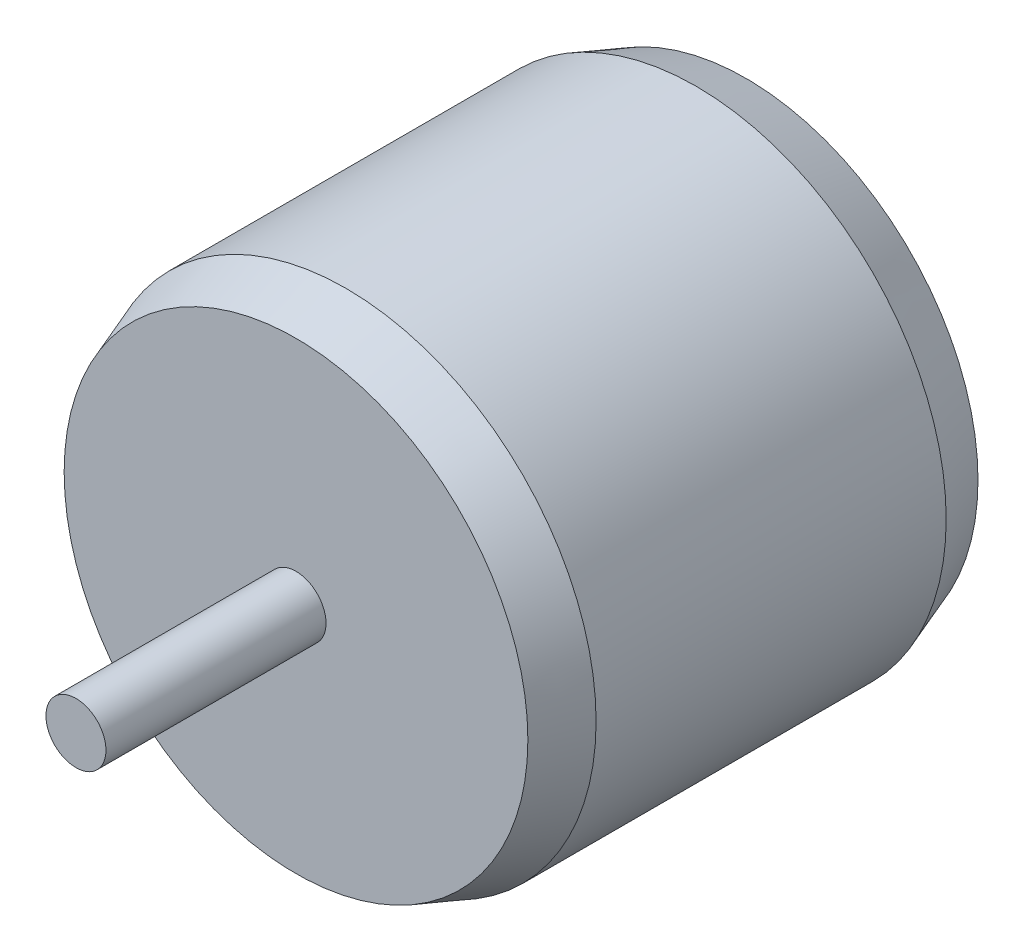
from build123d import *

# Parameters (mm, degrees)
SKETCH1_R           = 25
BOSS_EXTRUDE1_DEPTH = 45
CHAMFER1_SIZE       = 5
CHAMFER1_SIZE2      = 1.819851171
SKETCH2_R           = 3
BOSS_EXTRUDE2_DEPTH = 22
BOSS_EXTRUDE3_START = 2
SKETCH3_R           = 3
BOSS_EXTRUDE3_DEPTH = 2
CIRPATTERN1_COUNT   = 4


with BuildPart() as part:
    # Sketch1 → Boss-Extrude1 (new body)
    with BuildSketch(Plane.XY):
        with Locations(Location((0, 0, 0), (0, 0, 180))):
            Circle(SKETCH1_R)
    extrude(amount=BOSS_EXTRUDE1_DEPTH)

    # Chamfer1
    chamfer1_edges = [part.edges().sort_by_distance(p)[0] for p in [
        (25, 0, 0),
        (25, 0, 45),
    ]]
    chamfer1_side = [part.faces().sort_by_distance(p)[0] for p in [
        (25, 0, 22.5),
    ]]
    chamfer(chamfer1_edges, length=CHAMFER1_SIZE, length2=CHAMFER1_SIZE2, reference=chamfer1_side[0])

    # Sketch2 → Boss-Extrude2 (add)
    with BuildSketch(Plane.XY.offset(45)):
        Circle(SKETCH2_R)
    extrude(amount=BOSS_EXTRUDE2_DEPTH)

    # Sketch3 → Boss-Extrude3 (add)
    with BuildSketch(Plane(origin=(0, 0, 0), x_dir=(-1, 0, 0), z_dir=(0, 0, -1)).offset(BOSS_EXTRUDE3_START)):
        with Locations(Location((0, 0, 0), (0, 0, 180))):
            Circle(SKETCH3_R)
    extrude(amount=-BOSS_EXTRUDE3_DEPTH)

    # Sketch5 → Tap Drill for M3x0.5 Tap1 (revolve, cut)
    with BuildSketch(Plane(origin=(0, 10, 0), x_dir=(0, 1, 0), z_dir=(1, 0, 0))):
        Polygon((0, 0), (0, 10.751075774), (1.25, 10), (1.25, 0), align=None)
    tap_drill_for_m3x0_5_tap1 = revolve(axis=Axis((0, 10, -6.35), (0, 0, 1)), mode=Mode.SUBTRACT)

    # CirPattern1: Tap Drill for M3x0.5 Tap1 ×4 about axis
    cirpattern1_axis = Axis((0, 0, 0), (0, 0, 1))
    for i in range(1, CIRPATTERN1_COUNT):
        add(tap_drill_for_m3x0_5_tap1.rotate(cirpattern1_axis, i * 360 / CIRPATTERN1_COUNT), mode=Mode.SUBTRACT)


solid = part.part
